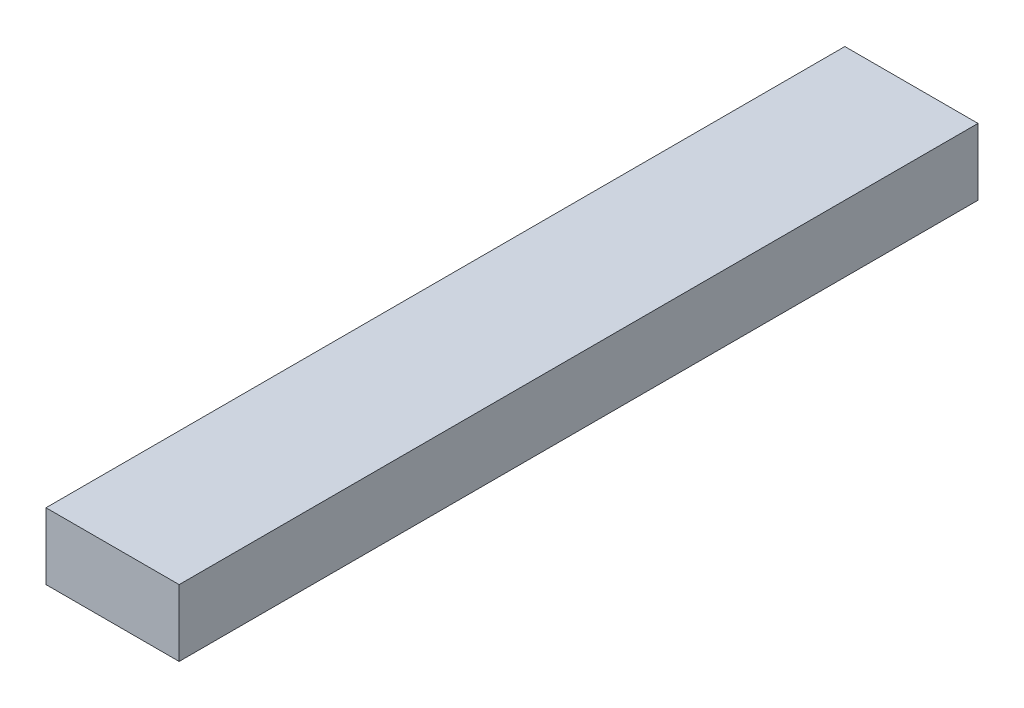
from build123d import *

# Parameters (mm, degrees)
SKETCH1_W           = 101.6
SKETCH1_H           = 50.8
BOSS_EXTRUDE1_DEPTH = 609.6


with BuildPart() as part:
    # Sketch1 → Boss-Extrude1 (new body)
    with BuildSketch(Plane.XY):
        Rectangle(SKETCH1_W, SKETCH1_H)
    extrude(amount=BOSS_EXTRUDE1_DEPTH)


solid = part.part
